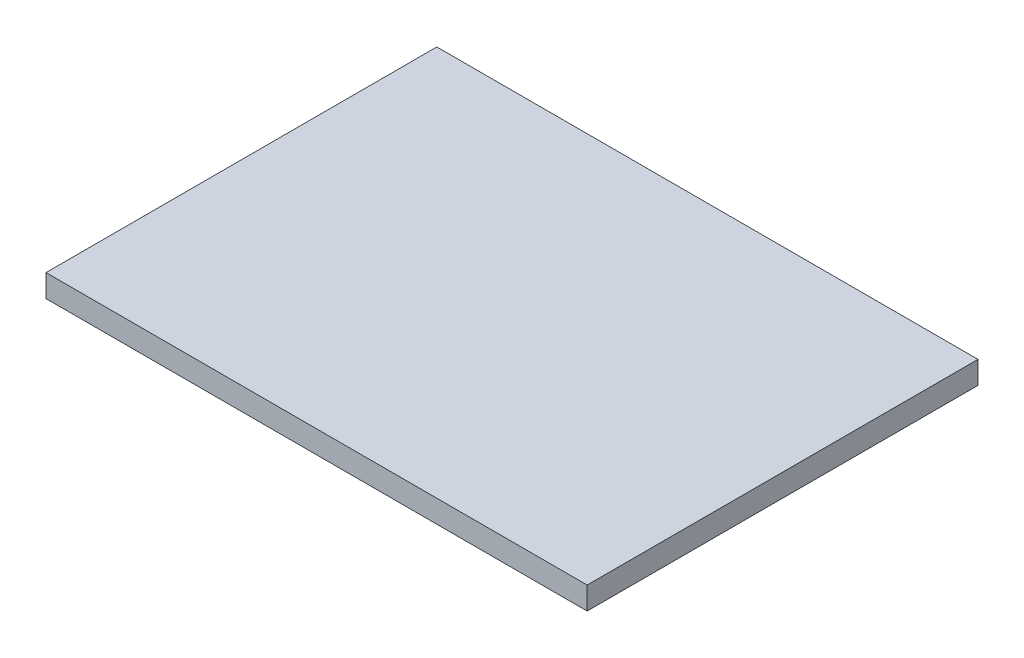
from build123d import *

# Parameters (mm, degrees)
SKETCH1_W           = 72
SKETCH1_H           = 52
BOSS_EXTRUDE1_DEPTH = 3


with BuildPart() as part:
    # Sketch1 → Boss-Extrude1 (new body)
    with BuildSketch(Plane(origin=(0, 0, 0), x_dir=(1, 0, 0), z_dir=(0, 1, 0))):
        Rectangle(SKETCH1_W, SKETCH1_H)
    extrude(amount=BOSS_EXTRUDE1_DEPTH)


solid = part.part
